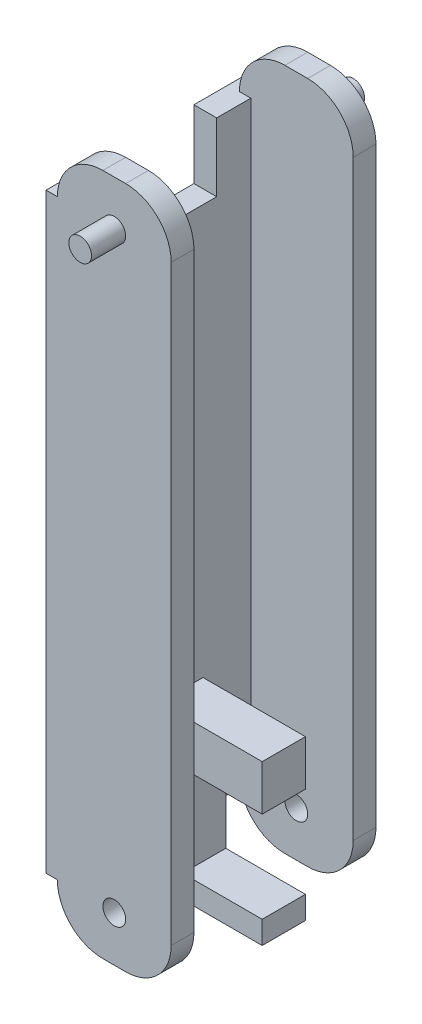
from build123d import *

# Parameters (mm, degrees)
SKETCH1_R           = 5
BOSS_EXTRUDE1_DEPTH = 10
SKETCH2_R           = 5
BOSS_EXTRUDE2_DEPTH = 15
SKETCH3_W           = 5
SKETCH3_H           = 260
BOSS_EXTRUDE3_DEPTH = 35
SKETCH8_W           = 5
SKETCH8_H           = 19
BOSS_EXTRUDE4_DEPTH = 20
SKETCH9_W           = 19
SKETCH9_H           = 10
SKETCH9_H_2         = 20
BOSS_EXTRUDE5_DEPTH = 45
SKETCH10_W          = 19
SKETCH10_H          = 40
BOSS_EXTRUDE6_DEPTH = 10
BOSS_EXTRUDE7_DEPTH = 5
SKETCH12_W          = 40
SKETCH12_H          = 30
CUT_EXTRUDE1_DEPTH  = 10


with BuildPart() as part:
    # Sketch1 → Boss-Extrude1 (new body)
    with BuildSketch(Plane.XY):
        with BuildLine():
            Line((-5, -20), (5, -20))
            ThreePointArc((5, -20), (19.142135624, -14.142135624), (25, 0))
            Line((25, 0), (25, 260))
            ThreePointArc((25, 260), (19.142135624, 274.142135624), (5, 280))
            Line((5, 280), (-5, 280))
            ThreePointArc((-5, 280), (-19.142135624, 274.142135624), (-25, 260))
            Line((-25, 260), (-25, 0))
            ThreePointArc((-25, 0), (-19.142135624, -14.142135624), (-5, -20))
        make_face()
        Circle(SKETCH1_R, mode=Mode.SUBTRACT)
    boss_extrude1 = extrude(amount=BOSS_EXTRUDE1_DEPTH)

    # Sketch2 → Boss-Extrude2 (add)
    with BuildSketch(Plane.XY.offset(10)):
        with Locations((0, 260)):
            Circle(SKETCH2_R)
    boss_extrude2 = extrude(amount=BOSS_EXTRUDE2_DEPTH)

    # Sketch3 → Boss-Extrude3 (add)
    with BuildSketch(Plane(origin=(0, 0, 0), x_dir=(-1, 0, 0), z_dir=(0, 0, -1))):
        with Locations((22.5, 130)):
            Rectangle(SKETCH3_W, SKETCH3_H)
    boss_extrude3 = extrude(amount=BOSS_EXTRUDE3_DEPTH)

    # Mirror1: Boss-Extrude1, Boss-Extrude2, Boss-Extrude3 across plane
    add(boss_extrude1.mirror(Plane.XY.offset(-35)))
    add(boss_extrude2.mirror(Plane.XY.offset(-35)))
    add(boss_extrude3.mirror(Plane.XY.offset(-35)))

    # Sketch8 → Boss-Extrude4 (add)
    with BuildSketch(Plane.XZ):
        with Locations((-22.5, -39.5)):
            Rectangle(SKETCH8_W, SKETCH8_H)
    extrude(amount=BOSS_EXTRUDE4_DEPTH)

    # Sketch9 → Boss-Extrude5 (add)
    with BuildSketch(Plane(origin=(-20, 0, 0), x_dir=(0, 0, -1), z_dir=(1, 0, 0))):
        with Locations((39.5, -15)):
            Rectangle(SKETCH9_W, SKETCH9_H)
        with Locations((39.5, 40)):
            Rectangle(SKETCH9_W, SKETCH9_H_2)
    extrude(amount=BOSS_EXTRUDE5_DEPTH)

    # Sketch10 → Boss-Extrude6 (add)
    with BuildSketch(Plane(origin=(-20, 0, 0), x_dir=(0, 0, -1), z_dir=(1, 0, 0))):
        with Locations((39.5, 10)):
            Rectangle(SKETCH10_W, SKETCH10_H)
    extrude(amount=BOSS_EXTRUDE6_DEPTH)

    # Sketch11 → Boss-Extrude7 (add)
    with BuildSketch(Plane.ZY.offset(25)):
        Polygon((10, 0), (-30, 0), (-30, -20), (-49, -20), (-49, 0), (-80, 0), (-80, 260), (10, 260), align=None)
    extrude(amount=BOSS_EXTRUDE7_DEPTH)

    # Sketch12 → Cut-Extrude1 (cut)
    with BuildSketch(Plane.ZY.offset(30)):
        with Locations((-35, 245)):
            Rectangle(SKETCH12_W, SKETCH12_H)
    extrude(amount=-CUT_EXTRUDE1_DEPTH, mode=Mode.SUBTRACT)


solid = part.part
